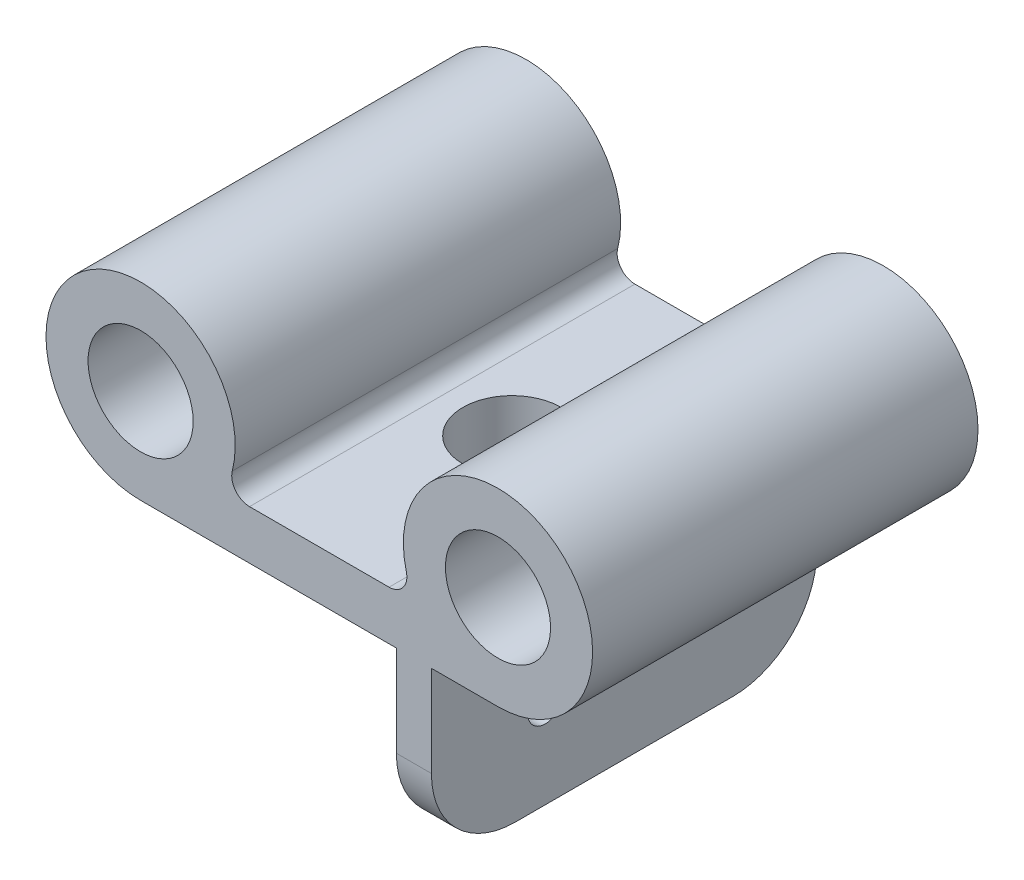
from build123d import *

# Parameters (mm, degrees)
SKETCH1_R           = 7.5
BOSS_EXTRUDE1_DEPTH = 55
FILLET1_R           = 2.54
BOSS_EXTRUDE2_DEPTH = 25
SKETCH4_R           = 7
CUT_EXTRUDE1_DEPTH  = 73.629195232
FILLET2_R           = 12
SKETCH5_R           = 2.5
CUT_EXTRUDE2_DEPTH  = 87.734978206


with BuildPart() as part:
    # Sketch1 → Boss-Extrude1 (new body)
    with BuildSketch(Plane.XY):
        with BuildLine():
            Line((-13.667840434, -6.5), (13.667840434, -6.5))
            ThreePointArc((13.667840434, -6.5), (32.373863542, 11.618950039), (25.5, -13.5))
            Line((25.5, -13.5), (-25.5, -13.5))
            ThreePointArc((-25.5, -13.5), (-32.373863542, 11.618950039), (-13.667840434, -6.5))
        make_face()
        with Locations((-25.5, 0)):
            Circle(SKETCH1_R, mode=Mode.SUBTRACT)
        with Locations(Location((25.5, 0, 0), (0, 0, 180))):
            Circle(SKETCH1_R, mode=Mode.SUBTRACT)
    extrude(amount=BOSS_EXTRUDE1_DEPTH)

    # Fillet1
    fillet1_edges = [part.edges().sort_by_distance(p)[0] for p in [
        (-13.667840434, -6.5, 27.5),
        (13.667840434, -6.5, 27.5),
    ]]
    fillet(fillet1_edges, radius=FILLET1_R)

    # Sketch2 → Boss-Extrude2 (add)
    with BuildSketch(Plane.XZ.offset(13.5)):
        Polygon((11, 15.637254902), (16, 10.245098039), (16, 55), (11, 55), align=None)
        Polygon((16, 0), (16, 10.245098039), (11, 15.637254902), (11, 0), align=None)
    extrude(amount=BOSS_EXTRUDE2_DEPTH)

    # Sketch4 → Cut-Extrude1 (cut, through all)
    with BuildSketch(Plane.XZ.offset(13.5)):
        with Locations((0, 27.5)):
            Circle(SKETCH4_R)
    extrude(amount=-CUT_EXTRUDE1_DEPTH, mode=Mode.SUBTRACT)

    # Fillet2
    fillet2_edges = [part.edges().sort_by_distance(p)[0] for p in [
        (13.5, -38.5, 0),
        (13.5, -38.5, 55),
    ]]
    fillet(fillet2_edges, radius=FILLET2_R)

    # Sketch5 → Cut-Extrude2 (cut, through all)
    with BuildSketch(Plane(origin=(11, 11.194119758, 4.468317801), x_dir=(0, 0, 1), z_dir=(-1, 0, 0))):
        with Locations(Location((11.781682199, -37.194119758, 0), (0, 0, 270))):
            Circle(SKETCH5_R)
        with Locations(Location((34.281682199, -37.194119758, 0), (0, 0, 270))):
            Circle(SKETCH5_R)
    extrude(amount=-CUT_EXTRUDE2_DEPTH, mode=Mode.SUBTRACT)


solid = part.part
